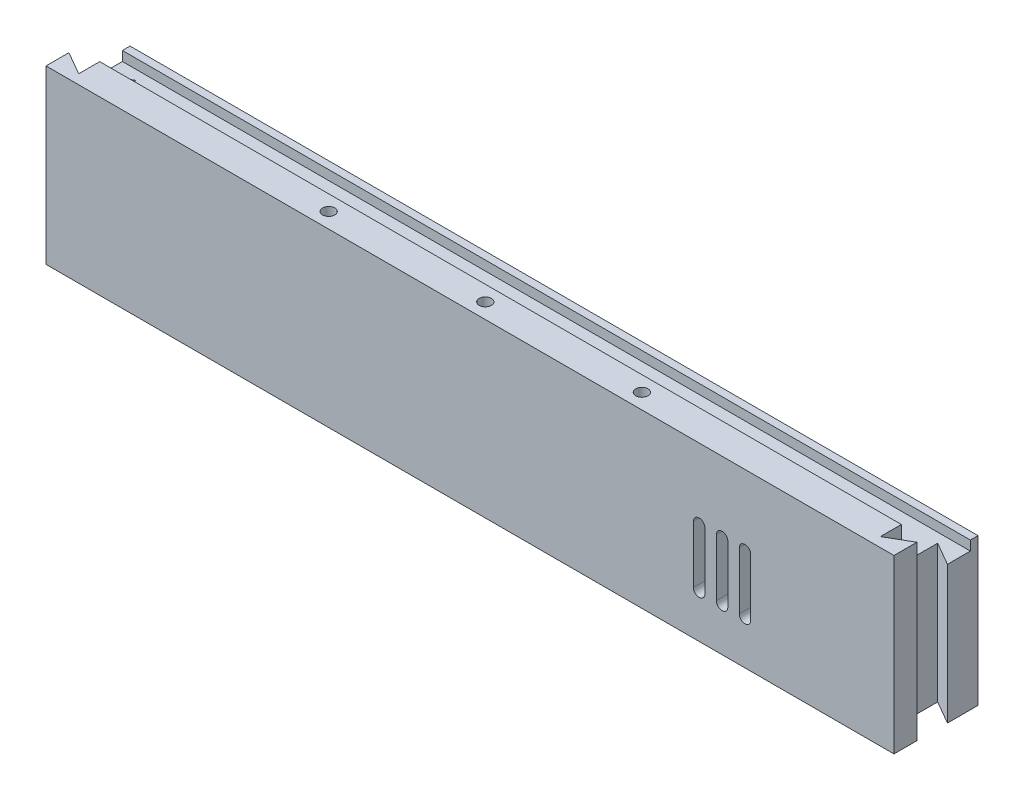
from build123d import *

# Parameters (mm, degrees)
SKETCH_1_W           = 270
SKETCH_1_H           = 370
SKETCH_1_W_2         = 250
SKETCH_1_H_2         = 350
EXTRUDE_2_DEPTH      = 45
SKETCH_4_W           = 250
SKETCH_4_H           = 350
SKETCH_4_W_2         = 222
SKETCH_4_H_2         = 322
EXTRUDE_3_DEPTH      = 5
SKETCH_9_W           = 246
SKETCH_9_H           = 346
SKETCH_9_W_2         = 226
SKETCH_9_H_2         = 326
CUT_EXTRUDE_3_DEPTH  = 2.5
SKETCH_12_R          = 1.6
CUT_EXTRUDE_5_DEPTH  = 109.5
FILLET_1_R           = 5
SKETCH_13_W          = 250
SKETCH_13_H          = 350
SKETCH_13_W_2        = 222
SKETCH_13_H_2        = 322
EXTRUDE_4_DEPTH      = 33.5
CUT_EXTRUDE_START    = -126.5
SKETCH_14_R          = 1.6
CUT_EXTRUDE_8_DEPTH  = 126.5
SKETCH_15_W          = 209.875644348
SKETCH_15_H          = 2
CUT_EXTRUDE_9_DEPTH  = 2.5
CUT_EXTRUDE_10_DEPTH = 60.5
SKETCH_18_R          = 1.6
CUT_EXTRUDE_11_DEPTH = 60.5
SKETCH_19_W          = 30
SKETCH_19_H          = 6
CUT_EXTRUDE_12_DEPTH = 30
CUT_EXTRUDE_13_DEPTH = 30
CUT_EXTRUDE_14_DEPTH = 55


with BuildPart() as part:
    # 草图1 → 凸台-拉伸2 (new body)
    with BuildSketch(Plane(origin=(0, 0, 0), x_dir=(1, 0, 0), z_dir=(0, 1, 0))):
        with Locations((125, 175)):
            Rectangle(SKETCH_1_W, SKETCH_1_H)
        with Locations((125, 175)):
            Rectangle(SKETCH_1_W_2, SKETCH_1_H_2, mode=Mode.SUBTRACT)
    extrude(amount=EXTRUDE_2_DEPTH)

    # 草图4 → 凸台-拉伸3 (add)
    with BuildSketch(Plane(origin=(0, 38.5, 0), x_dir=(1, 0, 0), z_dir=(0, 1, 0))):
        with Locations((125, 175)):
            Rectangle(SKETCH_4_W, SKETCH_4_H)
        with Locations((125, 175)):
            Rectangle(SKETCH_4_W_2, SKETCH_4_H_2, mode=Mode.SUBTRACT)
    extrude(amount=-EXTRUDE_3_DEPTH)

    # 草图9 → 切除-拉伸3 (cut)
    with BuildSketch(Plane(origin=(0, 38.5, 0), x_dir=(1, 0, 0), z_dir=(0, 1, 0))):
        with Locations((125, 175)):
            Rectangle(SKETCH_9_W, SKETCH_9_H)
        with Locations((125, 175)):
            Rectangle(SKETCH_9_W_2, SKETCH_9_H_2, mode=Mode.SUBTRACT)
    extrude(amount=-CUT_EXTRUDE_3_DEPTH, mode=Mode.SUBTRACT)

    # 草图12 → 切除-拉伸5 (cut)
    with BuildSketch(Plane(origin=(0, 45, 0), x_dir=(1, 0, 0), z_dir=(0, 1, 0))):
        with Locations(Location((-5, -5, 0), (0, 0, 270))):
            Circle(SKETCH_12_R)
        with BuildLine():
            ThreePointArc((-6.13137085, 356.13137085), (-6.13137085, 353.86862915), (-3.86862915, 353.86862915))
            Line((-3.86862915, 353.86862915), (-6.13137085, 356.13137085))
        make_face()
        with BuildLine():
            Line((-6.13137085, 356.13137085), (-3.86862915, 353.86862915))
            ThreePointArc((-3.86862915, 353.86862915), (-3.521792748, 354.387706508), (-3.4, 355))
            ThreePointArc((-3.4, 355), (-4.387706508, 356.478207252), (-6.13137085, 356.13137085))
        make_face()
        with Locations(Location((255, 355, 0), (0, 0, 270))):
            Circle(SKETCH_12_R)
        with Locations(Location((255, -5, 0), (0, 0, 270))):
            Circle(SKETCH_12_R)
    extrude(amount=-CUT_EXTRUDE_5_DEPTH, mode=Mode.SUBTRACT)

    # 圆角1
    fillet_1_edges = [part.edges().sort_by_distance(p)[0] for p in [
        (-10, 22.5, 10),
        (-10, 22.5, -360),
        (260, 22.5, -360),
        (260, 22.5, 10),
    ]]
    fillet(fillet_1_edges, radius=FILLET_1_R)

    # 草图13 → 凸台-拉伸4 (add)
    with BuildSketch(Plane.XZ.offset(-33.5)):
        with Locations((125, -175)):
            Rectangle(SKETCH_13_W, SKETCH_13_H)
        with Locations((125, -175)):
            Rectangle(SKETCH_13_W_2, SKETCH_13_H_2, mode=Mode.SUBTRACT)
    extrude(amount=EXTRUDE_4_DEPTH)

    # 草图14 → 切除-拉伸8 (cut)
    # profile 1 of 7: a face of its own
    with BuildSketch(Plane.XZ.offset(CUT_EXTRUDE_START)):
        with BuildLine():
            Line((14, -336), (14, -14))
            Line((14, -14), (14, -6))
            Line((14, -6), (14, 2))
            Line((14, 2), (14, 10))
            Line((14, 10), (-5, 10))
            ThreePointArc((-5, 10), (-8.535533906, 8.535533906), (-10, 5))
            Line((-10, 5), (-10, -355))
            ThreePointArc((-10, -355), (-8.535533906, -358.535533906), (-5, -360))
            Line((-5, -360), (255, -360))
            ThreePointArc((255, -360), (258.535533906, -358.535533906), (260, -355))
            Line((260, -355), (260, 5))
            ThreePointArc((260, 5), (258.535533906, 8.535533906), (255, 10))
            Line((255, 10), (236, 10))
            Line((236, 10), (236, 2))
            Line((236, 2), (236, -6))
            Line((236, -6), (236, -14))
            Line((236, -14), (236, -336))
            Line((236, -336), (14, -336))
        make_face()
        with Locations((-5, -355)):
            Circle(SKETCH_14_R, mode=Mode.SUBTRACT)
        with Locations((255, -355)):
            Circle(SKETCH_14_R, mode=Mode.SUBTRACT)
        with Locations((-5, 5)):
            Circle(SKETCH_14_R, mode=Mode.SUBTRACT)
        with Locations((255, 5)):
            Circle(SKETCH_14_R, mode=Mode.SUBTRACT)
    # profile 2 of 7: a face of its own
    with BuildSketch(Plane.XZ.offset(CUT_EXTRUDE_START)):
        Polygon((14, 2), (14, -6), (20.062177826, -9.5), (20.062177826, 5.5), align=None)
    # profile 3 of 7: a face of its own
    with BuildSketch(Plane.XZ.offset(CUT_EXTRUDE_START)):
        with Locations((-5, 5)):
            Circle(SKETCH_14_R)
    # profile 4 of 7: a face of its own
    with BuildSketch(Plane.XZ.offset(CUT_EXTRUDE_START)):
        Polygon((229.937822174, -9.5), (236, -6), (236, 2), (229.937822174, 5.5), align=None)
    # profile 5 of 7: a face of its own
    with BuildSketch(Plane.XZ.offset(CUT_EXTRUDE_START)):
        with Locations((255, 5)):
            Circle(SKETCH_14_R)
    # profile 6 of 7: a face of its own
    with BuildSketch(Plane.XZ.offset(CUT_EXTRUDE_START)):
        with Locations((255, -355)):
            Circle(SKETCH_14_R)
    # profile 7 of 7: a face of its own
    with BuildSketch(Plane.XZ.offset(CUT_EXTRUDE_START)):
        with Locations((-5, -355)):
            Circle(SKETCH_14_R)
    extrude(amount=CUT_EXTRUDE_8_DEPTH, mode=Mode.SUBTRACT)

    # 草图15 → 切除-拉伸9 (cut)
    with BuildSketch(Plane(origin=(0, 38.5, 0), x_dir=(1, 0, 0), z_dir=(0, 1, 0))):
        with Locations((125, 1)):
            Rectangle(SKETCH_15_W, SKETCH_15_H)
    extrude(amount=-CUT_EXTRUDE_9_DEPTH, mode=Mode.SUBTRACT)

    # 草图16 → 切除-拉伸10 (cut)
    with BuildSketch(Plane(origin=(0, 45, 0), x_dir=(1, 0, 0), z_dir=(0, 1, 0))):
        Polygon((236, -10), (236, -8), (234, -8), (229.607695155, -8), (14, -8), (14, -10), align=None)
    extrude(amount=-CUT_EXTRUDE_10_DEPTH, mode=Mode.SUBTRACT)

    # 草图18 → 切除-拉伸11 (cut)
    with BuildSketch(Plane(origin=(0, 45, 0), x_dir=(1, 0, 0), z_dir=(0, 1, 0))):
        with Locations(Location((166, -4, 0), (0, 0, 270))):
            Circle(SKETCH_18_R)
        with Locations(Location((84, -4, 0), (0, 0, 270))):
            Circle(SKETCH_18_R)
    extrude(amount=-CUT_EXTRUDE_11_DEPTH, mode=Mode.SUBTRACT)

    # 草图19 → 切除-拉伸12 (cut)
    with BuildSketch(Plane.XZ):
        with Locations((191, -11)):
            Rectangle(SKETCH_19_W, SKETCH_19_H)
    extrude(amount=-CUT_EXTRUDE_12_DEPTH, mode=Mode.SUBTRACT)

    # 草图20 → 切除-拉伸13 (cut)
    with BuildSketch(Plane(origin=(0, 0, -8), x_dir=(-1, 0, 0), z_dir=(0, 0, -1))):
        with BuildLine():
            Line((-198.5, 26.5), (-198.5, 19))
            Line((-198.5, 19), (-195.5, 19))
            Line((-195.5, 19), (-195.5, 26.5))
            ThreePointArc((-195.5, 26.5), (-197, 28), (-198.5, 26.5))
        make_face()
        with BuildLine():
            Line((-195.5, 19), (-198.5, 19))
            Line((-198.5, 19), (-198.5, 11.5))
            ThreePointArc((-198.5, 11.5), (-197, 10), (-195.5, 11.5))
            Line((-195.5, 11.5), (-195.5, 19))
        make_face()
        with BuildLine():
            Line((-191, 10), (-191, 19))
            Line((-191, 19), (-192.5, 19))
            Line((-192.5, 19), (-192.5, 11.5))
            ThreePointArc((-192.5, 11.5), (-192.060660172, 10.439339828), (-191, 10))
        make_face()
        with BuildLine():
            Line((-189.5, 19), (-191, 19))
            Line((-191, 19), (-191, 10))
            ThreePointArc((-191, 10), (-189.939339828, 10.439339828), (-189.5, 11.5))
            Line((-189.5, 11.5), (-189.5, 19))
        make_face()
        with BuildLine():
            ThreePointArc((-189.5, 26.5), (-189.939339828, 27.560660172), (-191, 28))
            Line((-191, 28), (-191, 19))
            Line((-191, 19), (-189.5, 19))
            Line((-189.5, 19), (-189.5, 26.5))
        make_face()
        with BuildLine():
            Line((-191, 19), (-191, 28))
            ThreePointArc((-191, 28), (-192.060660172, 27.560660172), (-192.5, 26.5))
            Line((-192.5, 26.5), (-192.5, 19))
            Line((-192.5, 19), (-191, 19))
        make_face()
        with BuildLine():
            Line((-186.5, 19), (-183.5, 19))
            Line((-183.5, 19), (-183.5, 26.5))
            ThreePointArc((-183.5, 26.5), (-185, 28), (-186.5, 26.5))
            Line((-186.5, 26.5), (-186.5, 19))
        make_face()
        with BuildLine():
            Line((-183.5, 11.5), (-183.5, 19))
            Line((-183.5, 19), (-186.5, 19))
            Line((-186.5, 19), (-186.5, 11.5))
            ThreePointArc((-186.5, 11.5), (-185, 10), (-183.5, 11.5))
        make_face()
    extrude(amount=-CUT_EXTRUDE_13_DEPTH, mode=Mode.SUBTRACT)

    # 草图22 → 切除-拉伸14 (cut)
    with BuildSketch(Plane(origin=(0, 45, 0), x_dir=(1, 0, 0), z_dir=(0, 1, 0))):
        with BuildLine():
            ThreePointArc((126.6, -4), (126.13137085, -2.86862915), (125, -2.4))
            Line((125, -2.4), (125, -5.6))
            ThreePointArc((125, -5.6), (126.13137085, -5.13137085), (126.6, -4))
        make_face()
        with BuildLine():
            Line((125, -5.6), (125, -2.4))
            ThreePointArc((125, -2.4), (123.4, -4), (125, -5.6))
        make_face()
    extrude(amount=-CUT_EXTRUDE_14_DEPTH, mode=Mode.SUBTRACT)


solid = part.part
